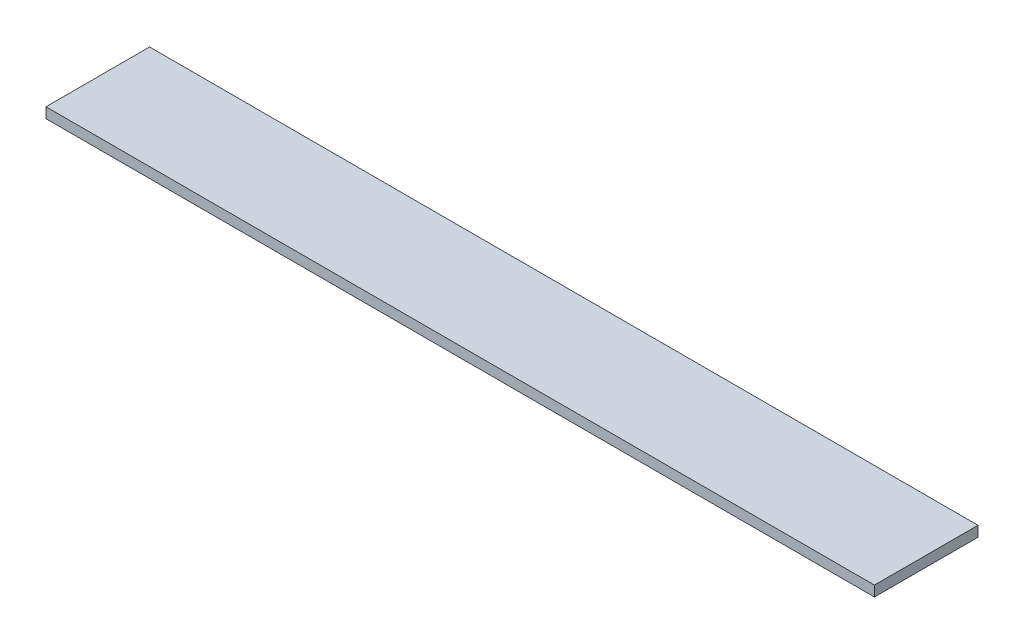
from build123d import *

# Parameters (mm, degrees)
SKETCH1_W           = 203.2
SKETCH1_H           = 25.4
BOSS_EXTRUDE1_DEPTH = 2.54


with BuildPart() as part:
    # Sketch1 → Boss-Extrude1 (new body)
    with BuildSketch(Plane(origin=(0, 0, 0), x_dir=(1, 0, 0), z_dir=(0, 1, 0))):
        with Locations((101.6, 12.7)):
            Rectangle(SKETCH1_W, SKETCH1_H)
    extrude(amount=BOSS_EXTRUDE1_DEPTH)


solid = part.part
